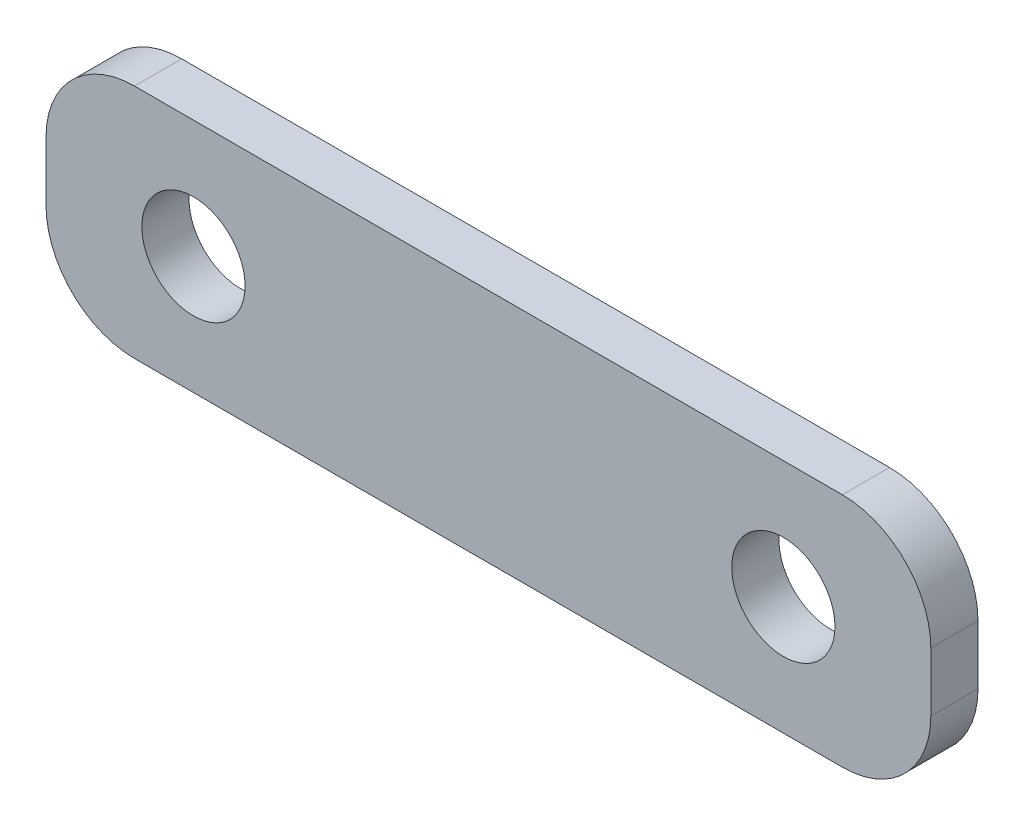
from build123d import *

# Parameters (mm, degrees)
ESBO_O1_W                                = 150
ESBO_O1_H                                = 40
RESSALTO_EXTRUS_O1_DEPTH                 = 4
FILETE2_R                                = 15
BROCA_DE_ROSQUEAR_PARA_TARRAXA_DE_M201_D = 17.5


with BuildPart() as part:
    # Esboço1 → Ressalto-extrusão1 (new, symmetric)
    with BuildSketch(Plane.XY):
        with Locations((75, 20)):
            Rectangle(ESBO_O1_W, ESBO_O1_H)
    extrude(amount=RESSALTO_EXTRUS_O1_DEPTH, both=True)

    # Filete2
    filete2_edges = [part.edges().sort_by_distance(p)[0] for p in [
        (0, 0, 0),
        (0, 40, 0),
        (150, 40, 0),
        (150, 0, 0),
    ]]
    fillet(filete2_edges, radius=FILETE2_R)

    # Broca de rosquear para tarraxa de M201 (through all)
    with Locations(Plane.XY.offset(4)):
        with Locations((25, 20), (125, 20)):
            Hole(BROCA_DE_ROSQUEAR_PARA_TARRAXA_DE_M201_D / 2)


solid = part.part
